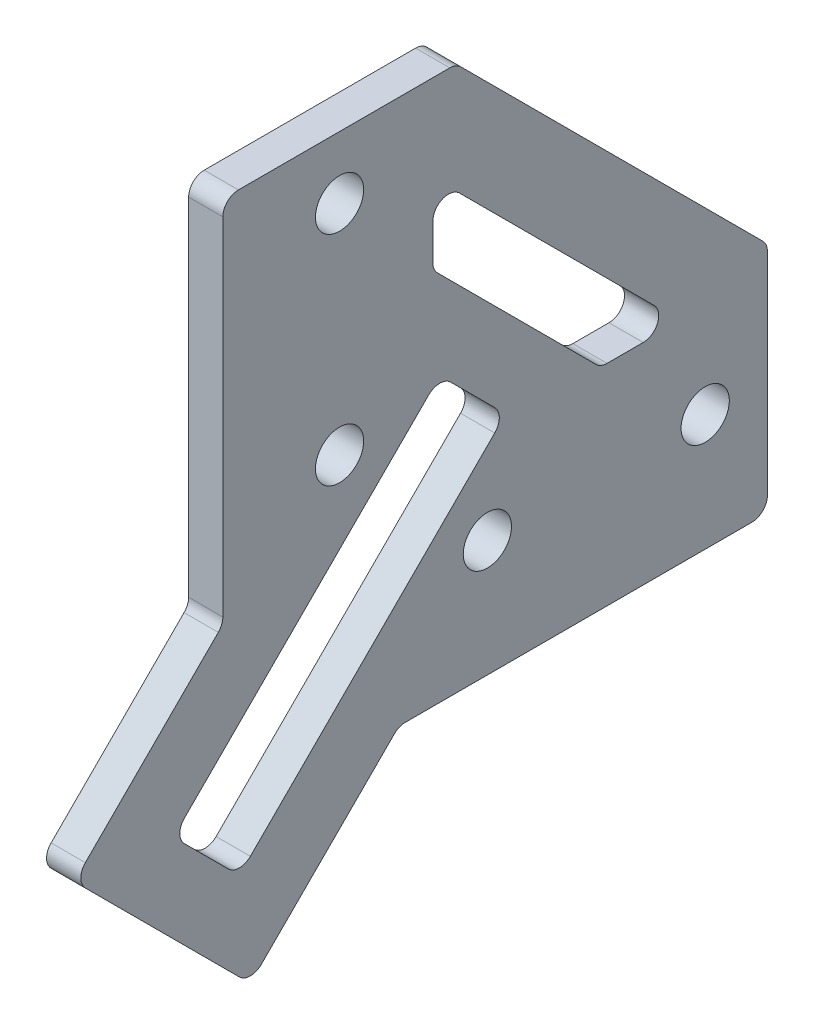
from build123d import *

# Parameters (mm, degrees)
SKETCH_1_R      = 1.55
EXTRUDE_1_DEPTH = 2.2
FILLET_1_R      = 1


with BuildPart() as part:
    # 草图1 → 凸台-拉伸1 (new body)
    with BuildSketch(Plane(origin=(0, 0, 0), x_dir=(0, 0, -1), z_dir=(1, 0, 0))):
        Polygon((11.313708499, 0), (35, 0), (35, 15), (15, 35), (0, 35), (0, 11.313708499), (-9.545941546, 1.767766953), (1.767766953, -9.545941546), align=None)
        with Locations((7.5, 31)):
            Circle(SKETCH_1_R, mode=Mode.SUBTRACT)
        with Locations((7.5, 17)):
            Circle(SKETCH_1_R, mode=Mode.SUBTRACT)
        with Locations(Location((31, 7.5, 0), (0, 0, 180))):
            Circle(SKETCH_1_R, mode=Mode.SUBTRACT)
        with Locations(Location((17, 7.5, 0), (0, 0, 180))):
            Circle(SKETCH_1_R, mode=Mode.SUBTRACT)
        Polygon((13.939339828, 18.181980515), (18.181980515, 13.939339828), (1.060660172, -3.181980515), (-3.181980515, 1.060660172), align=None, mode=Mode.SUBTRACT)
        Polygon((13.5, 29.428932188), (13.5, 24.278174593), (24.278174593, 13.5), (29.428932188, 13.5), align=None, mode=Mode.SUBTRACT)
    extrude(amount=EXTRUDE_1_DEPTH)

    # 圆角1
    fillet_1_edges = [part.edges().sort_by_distance(p)[0] for p in [
        (1.1, 35, 0),
        (1.1, 35, -15),
        (1.1, 15, -35),
        (1.1, 0, -35),
        (1.1, 0, -11.313708499),
        (1.1, -9.545941546, -1.767766953),
        (1.1, 1.767766953, 9.545941546),
        (1.1, 11.313708499, 0),
        (1.1, 18.181980515, -13.939339828),
        (1.1, 1.060660172, 3.181980515),
        (1.1, -3.181980515, -1.060660172),
        (1.1, 13.939339828, -18.181980515),
        (1.1, 13.5, -24.278174593),
        (1.1, 13.5, -29.428932188),
        (1.1, 29.428932188, -13.5),
        (1.1, 24.278174593, -13.5),
    ]]
    fillet(fillet_1_edges, radius=FILLET_1_R)


solid = part.part
